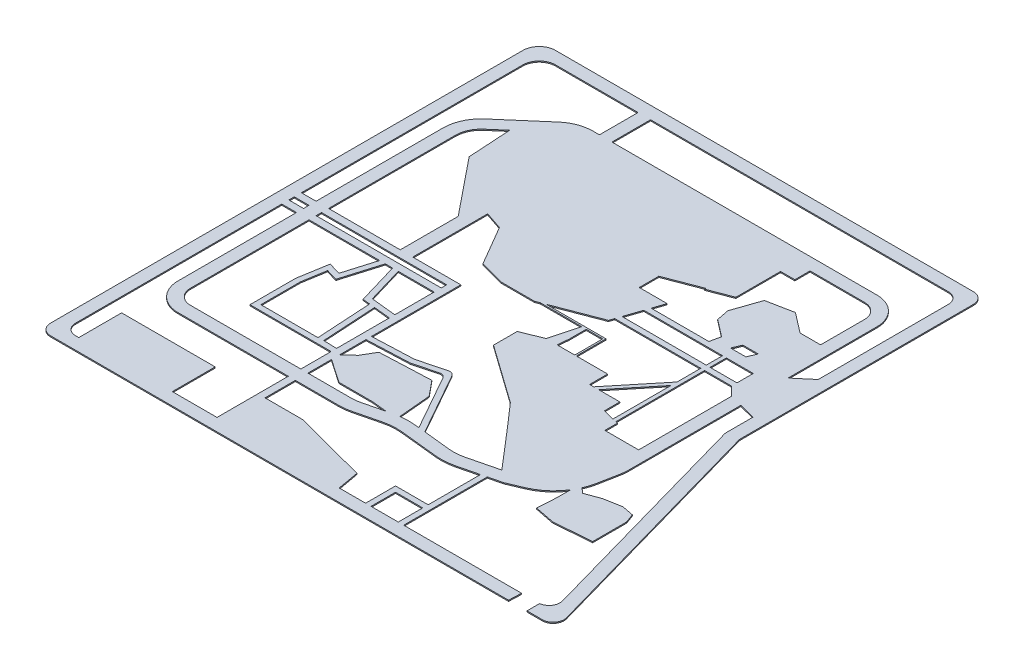
from build123d import *

# Parameters (mm, degrees)
EXTRUDE_1_DEPTH = 2
EXTRUDE_3_DEPTH = 2
EXTRUDE_2_DEPTH = 2
SKETCH_6_W      = 49.452960585
SKETCH_6_H      = 30
EXTRUDE_4_DEPTH = 2
SKETCH_7_W      = 171.961209249
SKETCH_7_H      = 84.756811905
EXTRUDE_5_DEPTH = 2


with BuildPart() as part:
    # 草图1 → 凸台-拉伸1 (new body)
    with BuildSketch(Plane(origin=(0, 0, 0), x_dir=(1, 0, 0), z_dir=(0, 1, 0))):
        with BuildLine():
            Line((-409, 379), (-409, -489))
            ThreePointArc((-409, -489), (-403.142135624, -503.142135624), (-389, -509))
            Line((-389, -509), (452.656628544, -509))
            Line((452.656628544, -509), (453.579886821, -486))
            Line((453.579886821, -486), (-366, -486))
            ThreePointArc((-366, -486), (-380.142135624, -480.142135624), (-386, -466))
            Line((-386, -466), (-386, 356))
            ThreePointArc((-386, 356), (-377.213203436, 377.213203436), (-356, 386))
            Line((-356, 386), (366, 386))
            ThreePointArc((366, 386), (380.142135624, 380.142135624), (386, 366))
            Line((386, 366), (386, -41.414981594))
            ThreePointArc((386, -41.414981594), (386.188641258, -44.155431339), (386.75100648, -46.844184895))
            Line((386.75100648, -46.844184895), (503.443127759, -460.5707967))
            ThreePointArc((503.443127759, -460.5707967), (500.833085531, -477.097085198), (486.578667088, -485.85734129))
            Line((486.578667088, -485.85734129), (486.578667088, -509))
            Line((486.578667088, -509), (514.578667088, -509))
            ThreePointArc((514.578667088, -509), (530.525203797, -501.070955513), (533.827660608, -483.5707967))
            Line((533.827660608, -483.5707967), (409.75100648, -43.662659339))
            ThreePointArc((409.75100648, -43.662659339), (409.188641258, -40.973905783), (409, -38.233456039))
            Line((409, -38.233456039), (409, 389))
            ThreePointArc((409, 389), (403.142135624, 403.142135624), (389, 409))
            Line((389, 409), (-379, 409))
            ThreePointArc((-379, 409), (-400.213203436, 400.213203436), (-409, 379))
        make_face()
    extrude(amount=EXTRUDE_1_DEPTH)



with BuildPart() as body_2:
    # 草图5 → 凸台-拉伸3 (new body)
    with BuildSketch(Plane(origin=(0, 0, 0), x_dir=(1, 0, 0), z_dir=(0, 1, 0))):
        with BuildLine():
            Line((-334.758813474, 235.108017739), (-261.982926375, 297.972926948))
            ThreePointArc((-261.982926375, 297.972926948), (-240.636150031, 310.605277556), (-216.224112901, 315))
            Line((-216.224112901, 315), (306, 315))
            ThreePointArc((306, 315), (341.355339059, 300.355339059), (356, 265))
            Line((356, 265), (356, -189.421706216))
            ThreePointArc((356, -189.421706216), (355.542542879, -198.975875842), (354.174356855, -208.44263301))
            Line((354.174356855, -208.44263301), (347.711896848, -241.797887554))
            ThreePointArc((347.711896848, -241.797887554), (327.223477791, -285.744373509), (288.470559167, -314.886786609))
            Line((288.470559167, -314.886786609), (261.2775095, -326.380756055))
            Line((261.2775095, -326.380756055), (190.41933354, -343.879173385))
            ThreePointArc((190.41933354, -343.879173385), (173.342652293, -346.557447602), (156.059865864, -346.254976996))
            Line((156.059865864, -346.254976996), (86.968459949, -339.04103526))
            ThreePointArc((86.968459949, -339.04103526), (69.685673521, -338.738564654), (52.608992274, -341.416838871))
            Line((52.608992274, -341.416838871), (9.415264282, -352.083524376))
            ThreePointArc((9.415264282, -352.083524376), (-2.483747638, -354.268203463), (-14.559499425, -355))
            Line((-14.559499425, -355), (-309, -355))
            ThreePointArc((-309, -355), (-344.355339059, -340.355339059), (-359, -305))
            Line((-359, -305), (-359, 182.135090791))
            ThreePointArc((-359, 182.135090791), (-352.651853638, 211.263110436), (-334.758813474, 235.108017739))
        make_face()
        with BuildLine():
            Line((-319.723774761, 217.702627456), (-246.947887662, 280.567536665))
            ThreePointArc((-246.947887662, 280.567536665), (-232.615052117, 289.049257788), (-216.224112901, 292))
            Line((-216.224112901, 292), (306, 292))
            ThreePointArc((306, 292), (325.091883092, 284.091883092), (333, 265))
            Line((333, 265), (333, -189.421706216))
            ThreePointArc((333, -189.421706216), (332.647758017, -196.778416828), (331.594254778, -204.067819847))
            Line((331.594254778, -204.067819847), (325.131794771, -237.423074391))
            ThreePointArc((325.131794771, -237.423074391), (309.355712098, -271.261868576), (279.515964757, -293.701526663))
            Line((279.515964757, -293.701526663), (253.997892197, -304.487516096))
            Line((253.997892197, -304.487516096), (184.905137887, -321.549962779))
            ThreePointArc((184.905137887, -321.549962779), (171.756093327, -323.612233926), (158.448347777, -323.379331559))
            Line((158.448347777, -323.379331559), (89.356941862, -316.165389823))
            ThreePointArc((89.356941862, -316.165389823), (68.099114555, -315.793350978), (47.094796621, -319.087628264))
            Line((47.094796621, -319.087628264), (3.901068629, -329.754313769))
            ThreePointArc((3.901068629, -329.754313769), (-5.261170549, -331.436516667), (-14.559499425, -332))
            Line((-14.559499425, -332), (-309, -332))
            ThreePointArc((-309, -332), (-328.091883092, -324.091883092), (-336, -305))
            Line((-336, -305), (-336, 182.135090791))
            ThreePointArc((-336, 182.135090791), (-331.737673157, 201.69247541), (-319.723774761, 217.702627456))
        make_face(mode=Mode.SUBTRACT)
    extrude(amount=EXTRUDE_3_DEPTH)


with BuildPart() as part_1:
    add(part.part)

    add(body_2.part)  # 凸台-拉伸2 merges body 2
    # 草图4 → 凸台-拉伸2 (add)
    # profile 1 of 2: a face of its own
    with BuildSketch(Plane(origin=(0, 0, 0), x_dir=(1, 0, 0), z_dir=(0, 1, 0))):
        with BuildLine():
            Line((-106, -486), (-106, -276.327539734))
            Line((-106, -276.327539734), (-255.125129415, -276.327539734))
            Line((-255.125129415, -276.327539734), (-255.125129415, -192.533488572))
            Line((-255.125129415, -192.533488572), (-246, -137.953673969))
            Line((-246, -137.953673969), (-223.385665455, -144.666426277))
            Line((-223.385665455, -144.666426277), (-206.268184714, -87))
            Line((-206.268184714, -87), (-386, -87))
            Line((-386, -87), (-386, -74))
            Line((-386, -74), (-106, -74))
            Line((-106, -74), (-106, -64))
            Line((-106, -64), (-386, -64))
            Line((-386, -64), (-386, -51))
            Line((-386, -51), (-93, -51))
            Line((-93, -51), (-93, -215.255841042))
            Line((-93, -215.255841042), (-16.721301568, -212.010874304))
            Line((-16.721301568, -212.010874304), (32.369647671, -199.160105651))
            ThreePointArc((32.369647671, -199.160105651), (38.804251594, -199.626914399), (43.614685571, -203.925956503))
            Line((43.614685571, -203.925956503), (107.93664233, -318.105325404))
            Line((107.93664233, -318.105325404), (99.2240209, -323.013505089))
            Line((99.2240209, -323.013505089), (38.686995625, -215.55285418))
            ThreePointArc((38.686995625, -215.55285418), (33.876561648, -211.253812076), (27.441957725, -210.787003328))
            Line((27.441957725, -210.787003328), (-15.225598887, -221.956290284))
            Line((-15.225598887, -221.956290284), (-93, -225.264885606))
            Line((-93, -225.264885606), (-93, -273.543707861))
            Line((-93, -273.543707861), (-74.956432389, -257.354290598))
            Line((-74.956432389, -257.354290598), (-60.923341397, -233.581693551))
            Line((-60.923341397, -233.581693551), (32.369647671, -229.612923072))
            Line((32.369647671, -229.612923072), (55.14283698, -257.354290598))
            Line((55.14283698, -257.354290598), (61.104809476, -323.013505089))
            Line((61.104809476, -323.013505089), (12.018138045, -318.105325404))
            Line((12.018138045, -318.105325404), (-49.855443203, -318.105325404))
            Line((-49.855443203, -318.105325404), (-93, -288.570168018))
            Line((-93, -288.570168018), (-93, -410.759953648))
            Line((-93, -410.759953648), (-23.549180701, -410.759953648))
            Line((-23.549180701, -410.759953648), (111.491664392, -446.450267095))
            Line((111.491664392, -446.450267095), (119.678621543, -491.99888356))
            Line((119.678621543, -491.99888356), (-93, -486))
            Line((-93, -486), (-106, -486))
        make_face()
        Polygon((-106, -87), (-171.933261926, -87), (-152.054596958, -154.60429207), (-106, -159.32741913), align=None, mode=Mode.SUBTRACT)
        Polygon((-182.356611301, -87), (-159.754268553, -163.867102648), (-146.307289832, -165.246156929), (-140.25359496, -266.327539734), (-245.125129415, -266.327539734), (-245.125129415, -193.363670834), (-238.002108428, -150.75899673), (-216.644735952, -157.09863724), (-195.836925404, -87), align=None, mode=Mode.SUBTRACT)
        Polygon((-106, -266.327539734), (-106, -169.379869172), (-136.227462477, -166.279893157), (-130.271480512, -265.729717728), align=None, mode=Mode.SUBTRACT)
    # profile 2 of 2: a face of its own
    with BuildSketch(Plane(origin=(0, 0, 0), x_dir=(1, 0, 0), z_dir=(0, 1, 0))):
        Polygon((227, -486), (227, -441), (177, -441), (177, -486), (167, -486), (167, -431), (227, -431), (227, -334.845582565), (237, -326.463373141), (237, -486), align=None)
    extrude(amount=EXTRUDE_2_DEPTH)

    # 草图6 → 凸台-拉伸4 (add)
    # profile 1 of 2: a face of its own
    with BuildSketch(Plane(origin=(0, 0, 0), x_dir=(1, 0, 0), z_dir=(0, 1, 0))):
        Polygon((333.979261599, -269.201444949), (333.979261599, -300.407945862), (331.832774864, -336.543245422), (368.33419793, -343.740709126), (436.659403203, -338.523650186), (436.659403203, -276.09379713), (430.520406468, -259.405890816), (409.455370098, -255.252221673), (377.670041067, -260.959763981), (350.440465425, -270.976735122), (339.642714152, -260.959763981), align=None)
    # profile 2 of 2: a face of its own
    with BuildSketch(Plane(origin=(0, 0, 0), x_dir=(1, 0, 0), z_dir=(0, 1, 0))):
        Polygon((333, -150.373527009), (271, -150.373527009), (271, -127.487909886), (267.269400404, -126.531345887), (267.269400404, 36.634426372), (316.722360989, 36.634426372), (333, 20.356787361), (386, 6.963521181), (386, 126.613493371), (356, 101.27429162), (333, 92.701553818), (333, 183.976345044), (295.302489019, 183.976345044), (258.47937009, 212.301821143), (210.72178431, 202.875981845), (193.567712189, 152.975424101), (198.144708571, 129.785309102), (229.214715159, 105.885304034), (225.001104106, 86.634426372), (118.944246127, 86.634426372), (126.38929153, 108.662548561), (75.18306655, 108.662548561), (75.18306655, 144.618200896), (138.344889515, 168.763758138), (137.594017698, 165.91301769), (179.465523125, 181.919693616), (179.465523125, 264.022990657), (205.682091341, 264.022990657), (205.682091341, 292), (-181.342436541, 292), (-181.342436541, 386), (-204.342436541, 386), (-204.342436541, 292), (-246.715708768, 292), (-294.059435188, 239.871871165), (-289.163877318, 160.421077074), (-204.342436541, 55.499397576), (-204.342436541, -51), (-181.342436541, -51), (-181.342436541, 86.634426372), (-148.672968683, 75.592828299), (-106.143389479, 2.647763136), (-59.93001865, -9.524624484), (0.756890679, -9.524624484), (8.519063562, -6.557294207), (84.546871063, -6.557294207), (70.969358634, -58.105325404), (33, -73.421133166), (33, -117.014958083), (91.13037803, -158.276696618), (139.916636236, -192.905850916), (177.205799041, -235.576954744), (239.409017264, -308.090236861), (275.485682645, -308.090236861), (316.722360989, -277.21507928), (339.642714152, -205.917077525), align=None)
        Polygon((239.409017264, -119.387657902), (239.409017264, -91.24168753), (200.463051685, -91.24168753), (260.269400404, -18.086976001), (260.269400404, -124.736474092), align=None, mode=Mode.SUBTRACT)
        Polygon((183.830418583, -91.24168753), (183.830418583, -58.105325404), (126.38929153, -58.105325404), (126.38929153, -3.557294207), (16.366696441, -3.557294207), (99.158239701, 28.092329778), (102.045290011, 36.634426372), (260.269400404, 36.634426372), (260.269400404, -7.027416177), (191.421502922, -91.24168753), align=None, mode=Mode.SUBTRACT)
        with Locations((291.995880697, 61.634426372)):
            Rectangle(SKETCH_6_W, SKETCH_6_H, mode=Mode.SUBTRACT)
        Polygon((115.564454904, 76.634426372), (105.425081234, 46.634426372), (260.269400404, 46.634426372), (260.269400404, 76.634426372), align=None, mode=Mode.SUBTRACT)
        Polygon((255.250407997, 96.155785363), (262.080895972, 112.193392729), (290.378631869, 112.193392729), (283.548143894, 96.155785363), align=None, mode=Mode.SUBTRACT)
        Polygon((92.906112081, -6.557294207), (92.906112081, -37.198733924), (91.13037803, -58.105325404), (123.38929153, -58.105325404), (123.38929153, -6.557294207), align=None, mode=Mode.SUBTRACT)
    extrude(amount=EXTRUDE_4_DEPTH)

    # 草图7 → 凸台-拉伸5 (add)
    with BuildSketch(Plane(origin=(0, 0, 0), x_dir=(1, 0, 0), z_dir=(0, 1, 0))):
        with Locations((-274.070637487, -449.667360864)):
            Rectangle(SKETCH_7_W, SKETCH_7_H)
    extrude(amount=EXTRUDE_5_DEPTH)


solid = part_1.part
